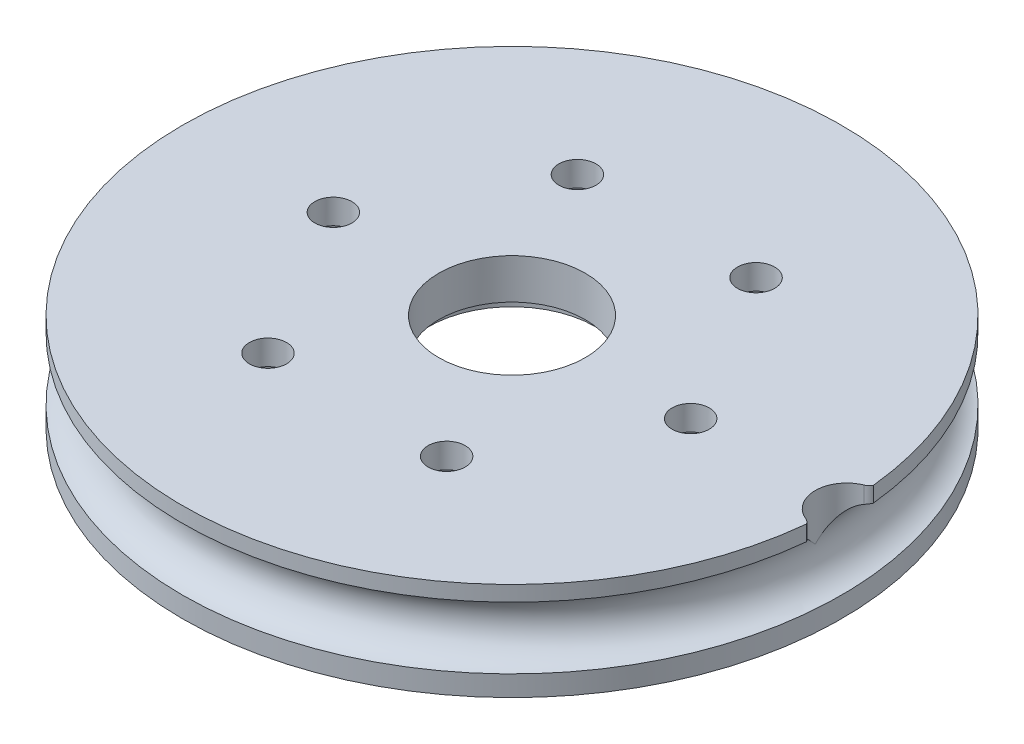
from build123d import *

# Parameters (mm, degrees)
SKETCH1_R                     = 32.15
BOSS_EXTRUDE1_DEPTH           = 4.5
SKETCH2_R                     = 32.15
SKETCH2_R_2                   = 4
BOSS_EXTRUDE2_DEPTH           = 5
SKETCH3_R                     = 1.8
CUT_EXTRUDE1_DEPTH            = 47.448842827
SKETCH7_R                     = 3.05
CUT_EXTRUDE2_REACH            = 48.449
CUT_EXTRUDE2_END_MAJOR_RADIUS = 32.45
CUT_EXTRUDE2_END_MINOR_RADIUS = 3.05
SKETCH8_R                     = 3.05
FILLET1_R                     = 1
FILLET2_R                     = 0.5
CUT_EXTRUDE3_DEPTH            = 2.6
SKETCH11_OUTSIDE_W            = 84.586
SKETCH11_OUTSIDE_H            = 84.586
SKETCH11_OUTSIDE_R            = 31.95
CUT_EXTRUDE5_DEPTH            = 47.448842986


with BuildPart() as part:
    # Sketch1 → Boss-Extrude1 (new body)
    with BuildSketch(Plane(origin=(0, 0, 0), x_dir=(1, 0, 0), z_dir=(0, 1, 0))):
        with Locations(Location((0, 0, 0), (0, 0, 270))):
            Circle(SKETCH1_R)
        with BuildLine():
            ThreePointArc((-1.865190823, 24.378152928), (1e-08, 23.1), (1.86519083, 24.378152947))
            ThreePointArc((1.86519083, 24.378152947), (6.618527356, 26.852420931), (9.677548101, 22.452579767))
            ThreePointArc((9.677548101, 22.452579767), (10.735105192, 20.454034236), (12.980636845, 20.718984864))
            ThreePointArc((12.980636845, 20.718984864), (18.33935709, 20.700854952), (19.00327734, 15.383391153))
            ThreePointArc((19.00327734, 15.383391153), (19.010927318, 13.122295627), (21.122375663, 12.313347308))
            ThreePointArc((21.122375663, 12.313347308), (25.858861233, 9.806972516), (23.975584858, 4.790053118))
            ThreePointArc((23.975584858, 4.790053118), (22.93157499, 2.784397325), (24.425232659, 1.086870142))
            ThreePointArc((24.425232659, 1.086870142), (27.454411871, -3.333569115), (23.455374783, -6.90062845))
            ThreePointArc((23.455374783, -6.90062845), (21.598875243, -8.191372795), (22.132563056, -10.388595774))
            ThreePointArc((22.132563056, -10.388595774), (22.760487594, -15.710430252), (17.561820805, -17.010459115))
            ThreePointArc((17.561820805, -17.010459115), (15.318133153, -17.290598506), (14.769590372, -19.484160262))
            ThreePointArc((14.769590372, -19.484160262), (12.85240973, -24.488221216), (7.645065691, -23.223398817))
            ThreePointArc((7.645065691, -23.223398817), (5.528191895, -22.42875597), (4.023082094, -24.116137495))
            ThreePointArc((4.023082094, -24.116137495), (1.8e-08, -27.656055652), (-4.02308209, -24.11613753))
            ThreePointArc((-4.02308209, -24.11613753), (-5.528191796, -22.428755995), (-7.645065594, -23.223398679))
            ThreePointArc((-7.645065594, -23.223398679), (-12.852409636, -24.488221266), (-14.769590388, -19.484160304))
            ThreePointArc((-14.769590388, -19.484160304), (-15.318133152, -17.290598507), (-17.561820842, -17.010459135))
            ThreePointArc((-17.561820842, -17.010459135), (-22.760487562, -15.710430298), (-22.13256317, -10.388595877))
            ThreePointArc((-22.13256317, -10.388595877), (-21.598875191, -8.191372929), (-23.455374648, -6.900628451))
            ThreePointArc((-23.455374648, -6.900628451), (-27.454411853, -3.333569265), (-24.425232819, 1.086870102))
            ThreePointArc((-24.425232819, 1.086870102), (-22.931575006, 2.784397195), (-23.975584774, 4.790053073))
            ThreePointArc((-23.975584774, 4.790053073), (-25.858861243, 9.80697249), (-21.122375626, 12.313347299))
            ThreePointArc((-21.122375626, 12.313347299), (-19.010927268, 13.122295699), (-19.003277417, 15.383391265))
            ThreePointArc((-19.003277417, 15.383391265), (-18.339357096, 20.700854947), (-12.98063696, 20.718984965))
            ThreePointArc((-12.98063696, 20.718984965), (-10.73510534, 20.454034158), (-9.67754808, 22.452579586))
            ThreePointArc((-9.67754808, 22.452579586), (-6.618527435, 26.852420912), (-1.865190823, 24.378152928))
        make_face(mode=Mode.SUBTRACT)
    extrude(amount=BOSS_EXTRUDE1_DEPTH)

    # Sketch2 → Boss-Extrude2 (add)
    with BuildSketch(Plane(origin=(0, 4.5, 0), x_dir=(1, 0, 0), z_dir=(0, 1, 0))):
        with Locations(Location((0, 0, 0), (0, 0, 270))):
            Circle(SKETCH2_R)
        with Locations(Location((0, 0, 0), (0, 0, 270))):
            Circle(SKETCH2_R_2, mode=Mode.SUBTRACT)
    extrude(amount=BOSS_EXTRUDE2_DEPTH)

    # Sketch3 → Cut-Extrude1 (cut, through all)
    with BuildSketch(Plane(origin=(0, 9.5, 0), x_dir=(1, 0, 0), z_dir=(0, 1, 0))):
        with Locations(Location((-8.660254038, 15, 0), (0, 0, 270))):
            Circle(SKETCH3_R)
        with Locations(Location((8.660254038, 15, 0), (0, 0, 270))):
            Circle(SKETCH3_R)
        with Locations(Location((17.320508076, 0, 0), (0, 0, 270))):
            Circle(SKETCH3_R)
        with Locations(Location((8.660254038, -15, 0), (0, 0, 270))):
            Circle(SKETCH3_R)
        with Locations(Location((-8.660254038, -15, 0), (0, 0, 270))):
            Circle(SKETCH3_R)
        with Locations(Location((-17.320508076, 0, 0), (0, 0, 270))):
            Circle(SKETCH3_R)
    extrude(amount=-CUT_EXTRUDE1_DEPTH, mode=Mode.SUBTRACT)

    # Sketch5 → Cut-Revolve1 (revolve, cut)
    with BuildSketch(Plane.XY, mode=Mode.PRIVATE) as cut_revolve1_sk:
        Polygon((-3, 11.5), (-3, 4.5), (-8.1, 4.5), (-8.1, 5.6), (-7.1, 5.6), (-7.1, 11.5), align=None)
    revolve(cut_revolve1_sk.sketch.rotate(Axis((0, 0, 0), (0, 1, 0)), 270), axis=Axis((0, 0, 0), (0, 1, 0)), mode=Mode.SUBTRACT)

    # Sketch7 → Cut-Revolve2 (revolve, cut)
    with BuildSketch(Plane.XY, mode=Mode.PRIVATE) as cut_revolve2_sk:
        with Locations((32.45, 5)):
            Circle(SKETCH7_R)
    revolve(cut_revolve2_sk.sketch.rotate(Axis((0, 0, 0), (0, 1, 0)), 90), axis=Axis((0, 0, 0), (0, 1, 0)), mode=Mode.SUBTRACT)

    # Cut-Extrude2: up to this torus (the profile starts outside it)
    cut_extrude2_end = Plane(origin=(0, 5, 0), z_dir=(0, -1, 0)) * Torus(CUT_EXTRUDE2_END_MAJOR_RADIUS, CUT_EXTRUDE2_END_MINOR_RADIUS, mode=Mode.PRIVATE)
    # Sketch8 → Cut-Extrude2 (cut, up to the surface)
    with BuildSketch(Plane(origin=(0, 9.5, 0), x_dir=(1, 0, 0), z_dir=(0, 1, 0)), mode=Mode.PRIVATE) as cut_extrude2_sk1:
        with Locations((32.45, 0)):
            Circle(SKETCH8_R)
    cut_extrude2_tool1 = extrude(cut_extrude2_sk1.sketch, amount=-CUT_EXTRUDE2_REACH, mode=Mode.PRIVATE) - cut_extrude2_end
    add(cut_extrude2_tool1.solids().sort_by_distance((32.45, 9.5, 0))[0], mode=Mode.SUBTRACT)

    # Fillet1
    fillet1_edges = [part.edges().sort_by_distance(p)[0] for p in [
        (32.008050847, 8.767605021, 3.017810621),
        (32.008050847, 8.767605022, -3.017810621),
    ]]
    fillet(fillet1_edges, radius=FILLET1_R)

    # Fillet2
    fillet2_edges = [part.edges().sort_by_distance(p)[0] for p in [
        (-19.010927268, 0, -13.122295699),
        (-25.858861243, 0, -9.80697249),
        (-22.931575006, 0, -2.784397195),
        (-27.454411853, 0, 3.333569265),
        (-21.598875191, 0, 8.191372929),
        (-22.760487562, 0, 15.710430298),
        (-15.318133152, 0, 17.290598507),
        (-12.852409636, 0, 24.488221266),
        (-5.528191796, 0, 22.428755995),
        (1.8e-08, 0, 27.656055652),
        (5.528191895, 0, 22.42875597),
        (12.85240973, 0, 24.488221216),
        (15.318133153, 0, 17.290598506),
        (22.760487594, 0, 15.710430252),
        (21.598875243, 0, 8.191372795),
        (27.454411871, 0, 3.333569115),
        (22.93157499, 0, -2.784397325),
        (25.858861233, 0, -9.806972516),
        (19.010927318, 0, -13.122295627),
        (18.33935709, 0, -20.700854952),
        (10.735105192, 0, -20.454034236),
        (6.618527356, 0, -26.852420931),
        (1e-08, 0, -23.1),
        (-6.618527435, 0, -26.852420912),
        (-10.73510534, 0, -20.454034158),
        (-18.339357096, 0, -20.700854947),
    ]]
    fillet(fillet2_edges, radius=FILLET2_R)

    # Sketch9 → Cut-Extrude3 (cut)
    with BuildSketch(Plane.XZ.offset(-4.5)):
        Polygon((11.893415545, -15), (10.276834792, -12.2), (7.043673284, -12.2), (5.42709253, -15), (7.043673284, -17.8), (10.276834792, -17.8), align=None)
        Polygon((20.553669583, 0), (18.937088829, 2.8), (15.703927322, 2.8), (14.087346568, 0), (15.703927322, -2.8), (18.937088829, -2.8), align=None)
        Polygon((-7.043673284, -17.8), (-5.42709253, -15), (-7.043673284, -12.2), (-10.276834792, -12.2), (-11.893415545, -15), (-10.276834792, -17.8), align=None)
        Polygon((-18.937088829, -2.8), (-15.703927322, -2.8), (-14.087346568, 0), (-15.703927322, 2.8), (-18.937088829, 2.8), (-20.553669583, 0), align=None)
        Polygon((-11.893415545, 15), (-10.276834792, 12.2), (-7.043673284, 12.2), (-5.42709253, 15), (-7.043673284, 17.8), (-10.276834792, 17.8), align=None)
        Polygon((7.043673284, 17.8), (5.42709253, 15), (7.043673284, 12.2), (10.276834792, 12.2), (11.893415545, 15), (10.276834792, 17.8), align=None)
    extrude(amount=-CUT_EXTRUDE3_DEPTH, mode=Mode.SUBTRACT)

    # Sketch11 outside → Cut-Extrude5 (cut, through all)
    with BuildSketch(Plane(origin=(0, 9.5, 0), x_dir=(1, 0, 0), z_dir=(0, 1, 0))):
        Rectangle(SKETCH11_OUTSIDE_W, SKETCH11_OUTSIDE_H)
        with Locations(Location((0, 0, 0), (0, 0, 270))):
            Circle(SKETCH11_OUTSIDE_R, mode=Mode.SUBTRACT)
    extrude(amount=-CUT_EXTRUDE5_DEPTH, mode=Mode.SUBTRACT)


solid = part.part
